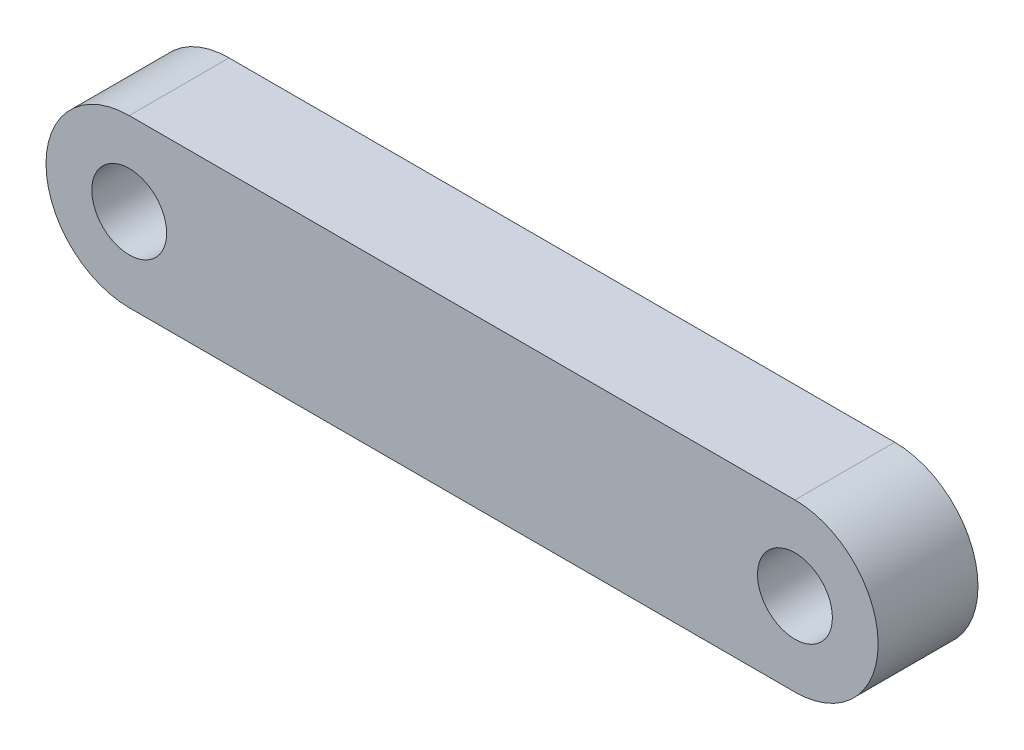
from build123d import *

# Parameters (mm, degrees)
SKETCH_1_R      = 2.25
EXTRUDE_1_DEPTH = 6


with BuildPart() as part:
    # Эскиз1 → Бобышка-Вытянуть1 (new body)
    with BuildSketch(Plane.XY):
        with BuildLine():
            Line((0, 5), (40, 5))
            ThreePointArc((40, 5), (45, 0), (40, -5))
            Line((40, -5), (0, -5))
            ThreePointArc((0, -5), (-5, 0), (0, 5))
        make_face()
        Circle(SKETCH_1_R, mode=Mode.SUBTRACT)
        with Locations((40, 0)):
            Circle(SKETCH_1_R, mode=Mode.SUBTRACT)
    extrude(amount=EXTRUDE_1_DEPTH)


solid = part.part
